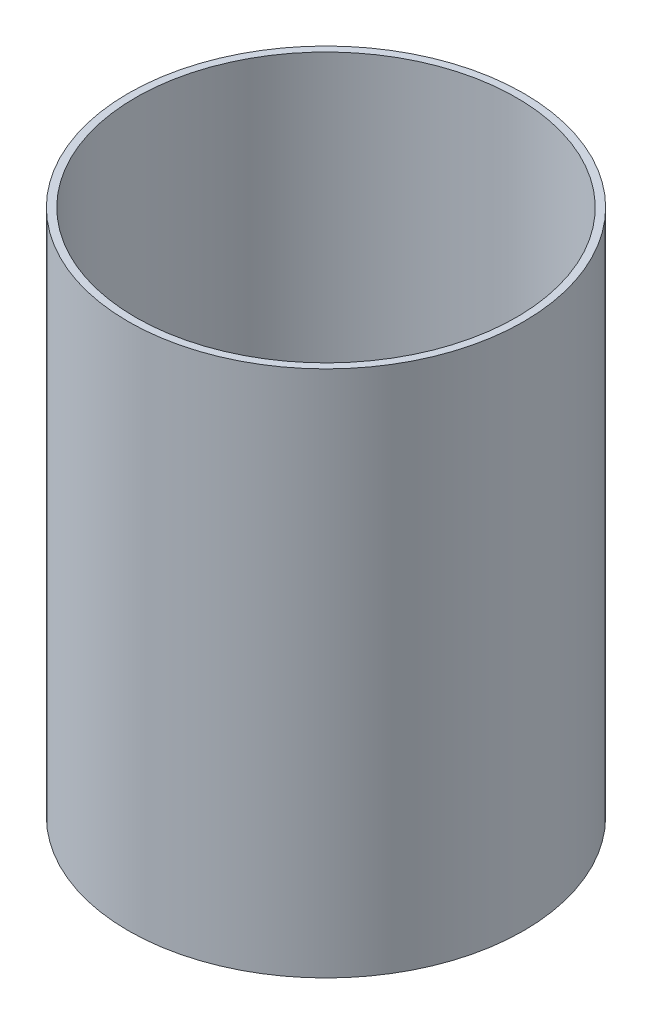
from build123d import *

# Parameters (mm, degrees)
COUPLER_PROFILE_R   = 76.1746
COUPLER_PROFILE_R_2 = 73.3425
COUPLER_BODY_DEPTH  = 203.2


with BuildPart() as part:
    # Coupler Profile → Coupler Body (new body)
    with BuildSketch(Plane(origin=(0, 0, 0), x_dir=(1, 0, 0), z_dir=(0, 1, 0))):
        with Locations(Location((0, 0, 0), (0, 0, 270))):
            Circle(COUPLER_PROFILE_R)
        with Locations(Location((0, 0, 0), (0, 0, 270))):
            Circle(COUPLER_PROFILE_R_2, mode=Mode.SUBTRACT)
    extrude(amount=COUPLER_BODY_DEPTH)


solid = part.part
